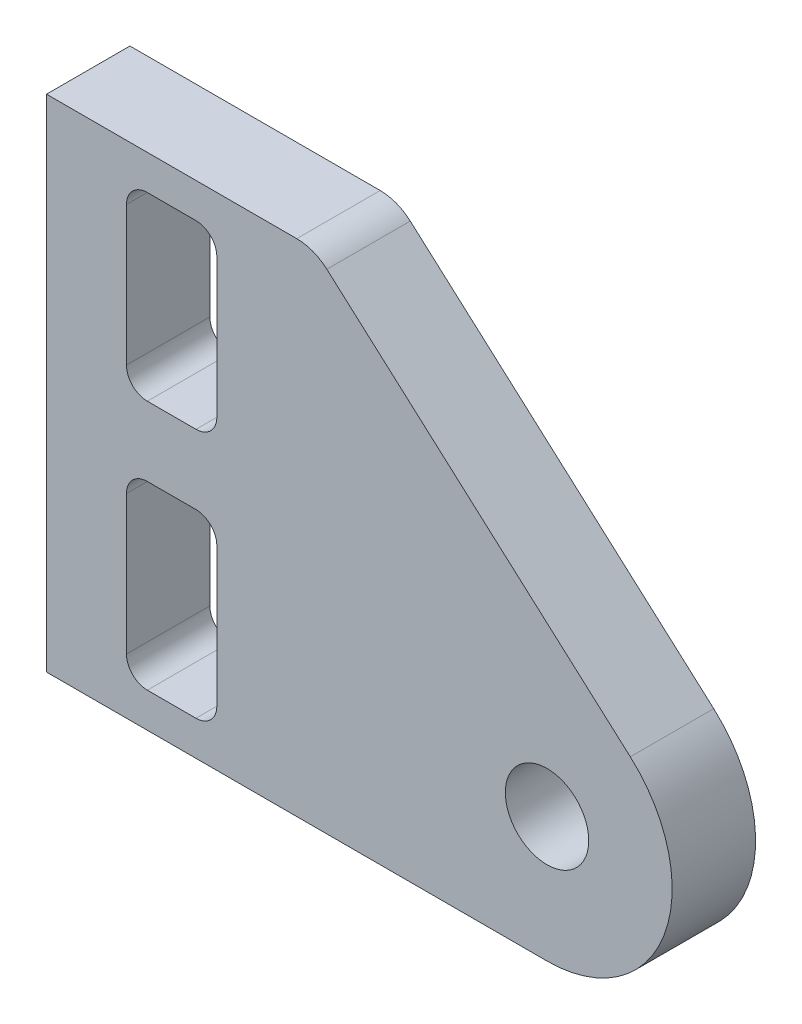
from build123d import *

# Parameters (mm, degrees)
MODEL_R                 = 1.5
SALIENTE_EXTRUIR1_DEPTH = 3


with BuildPart() as part:
    # Model → Saliente-Extruir1 (new body)
    with BuildSketch(Plane.XY):
        with BuildLine():
            Line((201.097853309, 264.646547335), (183.097853309, 264.646547335))
            Line((183.097853309, 264.646547335), (183.097853309, 282.646547335))
            Line((183.097853309, 282.646547335), (192.097853309, 282.646547335))
            ThreePointArc((192.097853309, 282.646547335), (192.676448554, 282.540050724), (193.179205728, 282.234519695))
            Line((193.179205728, 282.234519695), (204.092367701, 272.505547716))
            ThreePointArc((204.092367701, 272.505547716), (205.302939617, 267.544283579), (201.097853309, 264.646547335))
        make_face()
        with Locations((201.097853309, 269.146547335)):
            Circle(MODEL_R, mode=Mode.SUBTRACT)
        with BuildLine():
            Line((186.722853309, 265.896547335), (188.472853309, 265.896547335))
            ThreePointArc((188.472853309, 265.896547335), (189.003183395, 266.116217249), (189.222853309, 266.646547335))
            Line((189.222853309, 266.646547335), (189.222853309, 271.646547335))
            ThreePointArc((189.222853309, 271.646547335), (189.003183395, 272.176877421), (188.472853309, 272.396547335))
            Line((188.472853309, 272.396547335), (186.722853309, 272.396547335))
            ThreePointArc((186.722853309, 272.396547335), (186.192523223, 272.176877421), (185.972853309, 271.646547335))
            Line((185.972853309, 271.646547335), (185.972853309, 266.646547335))
            ThreePointArc((185.972853309, 266.646547335), (186.192523223, 266.116217249), (186.722853309, 265.896547335))
        make_face(mode=Mode.SUBTRACT)
        with BuildLine():
            Line((186.722853309, 274.895968764), (188.472853309, 274.895968764))
            ThreePointArc((188.472853309, 274.895968764), (189.003183395, 275.115638678), (189.222853309, 275.645968764))
            Line((189.222853309, 275.645968764), (189.222853309, 280.645968764))
            ThreePointArc((189.222853309, 280.645968764), (189.003183395, 281.17629885), (188.472853309, 281.395968764))
            Line((188.472853309, 281.395968764), (186.722853309, 281.395968764))
            ThreePointArc((186.722853309, 281.395968764), (186.192523223, 281.17629885), (185.972853309, 280.645968764))
            Line((185.972853309, 280.645968764), (185.972853309, 275.645968764))
            ThreePointArc((185.972853309, 275.645968764), (186.192523223, 275.115638678), (186.722853309, 274.895968764))
        make_face(mode=Mode.SUBTRACT)
    extrude(amount=SALIENTE_EXTRUIR1_DEPTH)


solid = part.part
